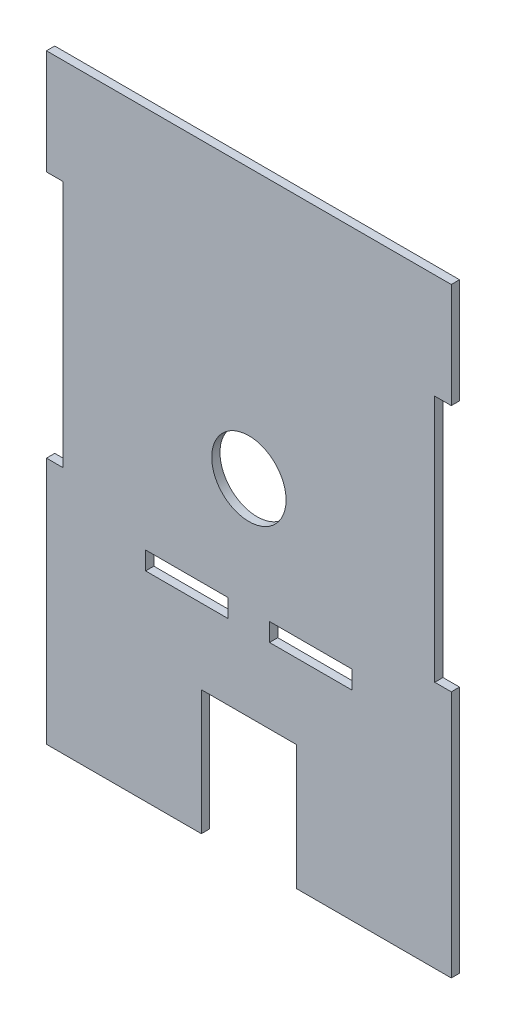
from build123d import *

# Parameters (mm, degrees)
MODEL_R         = 4.5
MODEL_W         = 10
MODEL_H         = 2.2
EXTRUDE_1_DEPTH = 1


with BuildPart() as part:
    # Model → 凸台-拉伸1 (new body)
    with BuildSketch(Plane.XY):
        Polygon((4.28201841, 3.652217339), (4.28201841, 33.652217339), (6.28201841, 33.652217339), (6.28201841, 63.652217339), (4.28201841, 63.652217339), (4.28201841, 76.353862753), (53.28201841, 76.353862753), (53.28201841, 63.652217339), (51.28201841, 63.652217339), (51.28201841, 33.652217339), (53.28201841, 33.652217339), (53.28201841, 3.652217339), (34.53201841, 3.652217339), (34.53201841, 18.752217339), (28.78201841, 18.752217339), (23.03201841, 18.752217339), (23.03201841, 3.652217339), align=None)
        with Locations((28.78201841, 43.752217339)):
            Circle(MODEL_R, mode=Mode.SUBTRACT)
        with Locations((36.28201841, 28.925280735)):
            Rectangle(MODEL_W, MODEL_H, mode=Mode.SUBTRACT)
        with Locations((21.28201841, 28.925280735)):
            Rectangle(MODEL_W, MODEL_H, mode=Mode.SUBTRACT)
    extrude(amount=EXTRUDE_1_DEPTH)


solid = part.part
